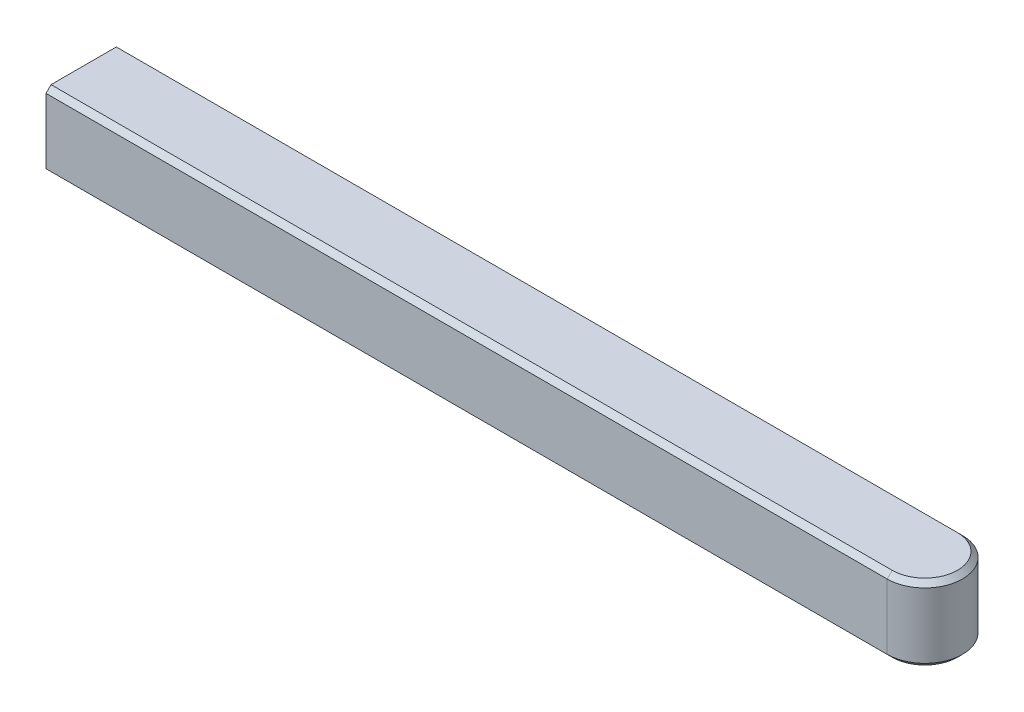
from build123d import *

# Parameters (mm, degrees)
SKETCH1_W           = 35
SKETCH1_H           = 3
BOSS_EXTRUDE1_DEPTH = 3
FILLET2_RADIUS      = 1.5
FILLET2_LENGTH      = 3
CHAMFER2_SIZE       = 0.2


with BuildPart() as part:
    # Sketch1 → Boss-Extrude1 (new body)
    with BuildSketch(Plane(origin=(0, 0, 0), x_dir=(1, 0, 0), z_dir=(0, 1, 0))):
        Rectangle(SKETCH1_W, SKETCH1_H)
    extrude(amount=BOSS_EXTRUDE1_DEPTH)

    # Fillet2: full round fillet: the end face becomes a half cylinder, R = half its width
    fillet2_face = Plane((17.5, 1.5, 0), x_dir=(0, 1, 0), z_dir=(1, 0, 0))  # on the end face: x along it, z out of the body
    fillet2_slab = fillet2_face.offset(-FILLET2_RADIUS / 2) * Box(FILLET2_LENGTH, 2 * FILLET2_RADIUS, FILLET2_RADIUS, mode=Mode.PRIVATE)  # the body's end, R deep
    fillet2_round = Plane((16, 1.5, 0), x_dir=(1, 0, 0), z_dir=(0, 1, 0)) * Cylinder(FILLET2_RADIUS, FILLET2_LENGTH, mode=Mode.PRIVATE)  # its axis R under the face
    add(fillet2_slab - fillet2_round, mode=Mode.SUBTRACT)

    # Chamfer2
    chamfer2_edges = [part.edges().sort_by_distance(p)[0] for p in [
        (-0.75, 0, -1.5),
        (-0.75, 3, -1.5),
        (17.5, 0, 0),
        (17.5, 3, 0),
        (-0.75, 0, 1.5),
        (-0.75, 3, 1.5),
    ]]
    chamfer(chamfer2_edges, length=CHAMFER2_SIZE)


solid = part.part
